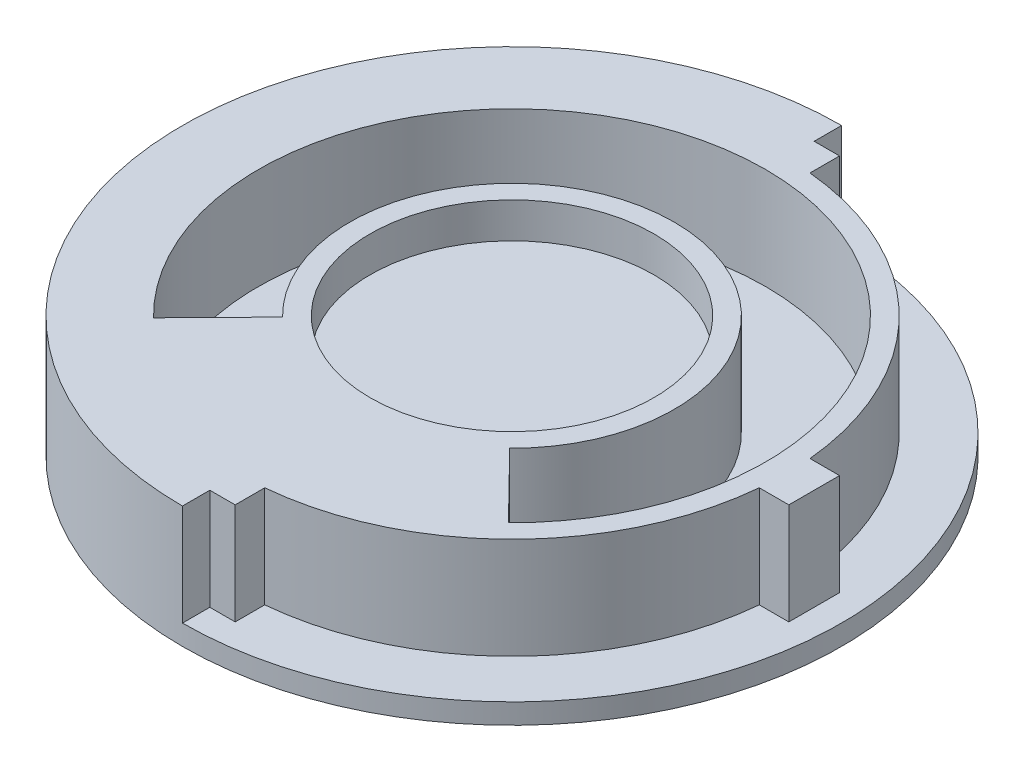
from build123d import *

# Parameters (mm, degrees)
SKETCH1_R           = 27
SKETCH1_R_2         = 14
BOSS_EXTRUDE1_DEPTH = 10
SKETCH2_R           = 32.5
BOSS_EXTRUDE2_DEPTH = 2
SKETCH3_W           = 5
SKETCH3_H           = 4.39677325
SKETCH3_W_2         = 4.39677325
SKETCH3_H_2         = 5
BOSS_EXTRUDE3_DEPTH = 10
CUT_EXTRUDE1_REACH  = 49.503
SKETCH4_R           = 0.9
BOSS_EXTRUDE4_DEPTH = 10
BOSS_EXTRUDE5_START = -2
SKETCH6_R           = 14
BOSS_EXTRUDE5_DEPTH = 2


with BuildPart() as part:
    # Sketch1 → Boss-Extrude1 (new body)
    with BuildSketch(Plane(origin=(0, 0, 0), x_dir=(1, 0, 0), z_dir=(0, 1, 0))):
        with Locations(Location((0, 0, 0), (0, 0, 270))):
            Circle(SKETCH1_R)
        with Locations(Location((0, 0, 0), (0, 0, 270))):
            Circle(SKETCH1_R_2, mode=Mode.SUBTRACT)
        with BuildLine():
            Line((-17.5, -17.853571071), (-11.2, -11.426285486))
            ThreePointArc((-11.2, -11.426285486), (0, 16), (11.2, -11.426285486))
            Line((11.2, -11.426285486), (17.5, -17.853571071))
            ThreePointArc((17.5, -17.853571071), (0, 25), (-17.5, -17.853571071))
        make_face(mode=Mode.SUBTRACT)
    extrude(amount=BOSS_EXTRUDE1_DEPTH)

    # Sketch2 → Boss-Extrude2 (add)
    with BuildSketch(Plane.XZ):
        with Locations(Location((0, 0, 0), (0, 0, 270))):
            Circle(SKETCH2_R)
    extrude(amount=BOSS_EXTRUDE2_DEPTH)

    # Sketch3 → Boss-Extrude3 (add)
    with BuildSketch(Plane(origin=(0, 0, 0), x_dir=(1, 0, 0), z_dir=(0, 1, 0))):
        with Locations((0, 27.601613375)):
            Rectangle(SKETCH3_W, SKETCH3_H)
        with Locations((27.601613375, 0)):
            Rectangle(SKETCH3_W_2, SKETCH3_H_2)
        with Locations((0, -27.601613375)):
            Rectangle(SKETCH3_W, SKETCH3_H)
        with Locations((-27.601613375, 0)):
            Rectangle(SKETCH3_W_2, SKETCH3_H_2)
    extrude(amount=BOSS_EXTRUDE3_DEPTH)

    # Sketch4 → Cut-Extrude1 (cut, up to next)
    with BuildSketch(Plane.XZ.offset(2), mode=Mode.PRIVATE) as cut_extrude1_sk1:
        with Locations(Location((0, -7, 0), (0, 0, 270))):
            Circle(SKETCH4_R)
    cut_extrude1_tool1 = extrude(cut_extrude1_sk1.sketch, amount=-CUT_EXTRUDE1_REACH, mode=Mode.PRIVATE) & part.part
    # Sketch4 → Cut-Extrude1 (cut, up to next)
    with BuildSketch(Plane.XZ.offset(2), mode=Mode.PRIVATE) as cut_extrude1_sk2:
        with Locations(Location((-7, 0, 0), (0, 0, 270))):
            Circle(SKETCH4_R)
    cut_extrude1_tool2 = extrude(cut_extrude1_sk2.sketch, amount=-CUT_EXTRUDE1_REACH, mode=Mode.PRIVATE) & part.part
    # Sketch4 → Cut-Extrude1 (cut, up to next)
    with BuildSketch(Plane.XZ.offset(2), mode=Mode.PRIVATE) as cut_extrude1_sk3:
        with Locations(Location((0, 7, 0), (0, 0, 270))):
            Circle(SKETCH4_R)
    cut_extrude1_tool3 = extrude(cut_extrude1_sk3.sketch, amount=-CUT_EXTRUDE1_REACH, mode=Mode.PRIVATE) & part.part
    # Sketch4 → Cut-Extrude1 (cut, up to next)
    with BuildSketch(Plane.XZ.offset(2), mode=Mode.PRIVATE) as cut_extrude1_sk4:
        with Locations(Location((7, 0, 0), (0, 0, 270))):
            Circle(SKETCH4_R)
    cut_extrude1_tool4 = extrude(cut_extrude1_sk4.sketch, amount=-CUT_EXTRUDE1_REACH, mode=Mode.PRIVATE) & part.part
    add(cut_extrude1_tool1.solids().sort_by_distance((0, -2, -7))[0], mode=Mode.SUBTRACT)
    add(cut_extrude1_tool2.solids().sort_by_distance((-7, -2, 0))[0], mode=Mode.SUBTRACT)
    add(cut_extrude1_tool3.solids().sort_by_distance((0, -2, 7))[0], mode=Mode.SUBTRACT)
    add(cut_extrude1_tool4.solids().sort_by_distance((7, -2, 0))[0], mode=Mode.SUBTRACT)

    # Sketch5 → Boss-Extrude4 (add)
    with BuildSketch(Plane(origin=(0, 0, 0), x_dir=(1, 0, 0), z_dir=(0, 1, 0))):
        with BuildLine():
            Line((0, 29.8), (0, 32.5))
            ThreePointArc((0, 32.5), (-32.5, 0), (0, -32.5))
            Line((0, -32.5), (0, -29.8))
            Line((0, -29.8), (-2.5, -29.8))
            Line((-2.5, -29.8), (-2.5, -26.884010118))
            ThreePointArc((-2.5, -26.884010118), (-19.091883092, -19.091883092), (-26.884010118, -2.5))
            Line((-26.884010118, -2.5), (-29.8, -2.5))
            Line((-29.8, -2.5), (-29.8, 2.5))
            Line((-29.8, 2.5), (-26.884010118, 2.5))
            ThreePointArc((-26.884010118, 2.5), (-19.091883092, 19.091883092), (-2.5, 26.884010118))
            Line((-2.5, 26.884010118), (-2.5, 29.8))
            Line((-2.5, 29.8), (0, 29.8))
        make_face()
    extrude(amount=BOSS_EXTRUDE4_DEPTH)

    # Sketch6 → Boss-Extrude5 (add)
    with BuildSketch(Plane(origin=(0, 6.5, 0), x_dir=(1, 0, 0), z_dir=(0, 1, 0)).offset(BOSS_EXTRUDE5_START)):
        with Locations(Location((0, 0, 0), (0, 0, 270))):
            Circle(SKETCH6_R)
    extrude(amount=BOSS_EXTRUDE5_DEPTH)


solid = part.part
